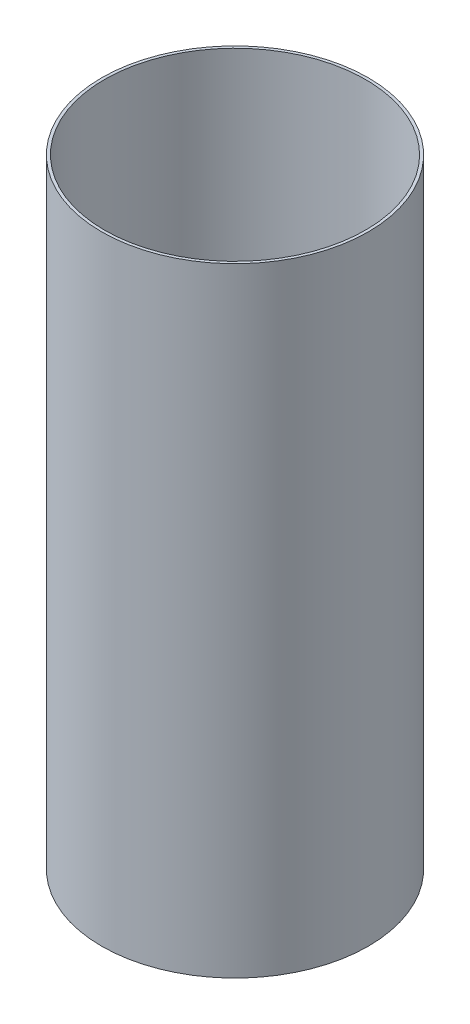
from build123d import *

# Parameters (mm, degrees)
BOSS_EXTRUDE1_DEPTH      = 181.7
BOSS_EXTRUDE1_DEPTH_BACK = 181.7
SKETCH1_R                = 78.35
SKETCH1_R_2              = 76.67


with BuildPart() as part:
    # Sketch1 → Boss-Extrude1 (new, two sides: drawn at the far end of the back side and taken through both)
    with BuildSketch(Plane(origin=(0, 0, 0), x_dir=(1, 0, 0), z_dir=(0, 1, 0)).offset(-BOSS_EXTRUDE1_DEPTH_BACK)):
        Circle(SKETCH1_R)
        Circle(SKETCH1_R_2, mode=Mode.SUBTRACT)
    extrude(amount=BOSS_EXTRUDE1_DEPTH + BOSS_EXTRUDE1_DEPTH_BACK)


solid = part.part
